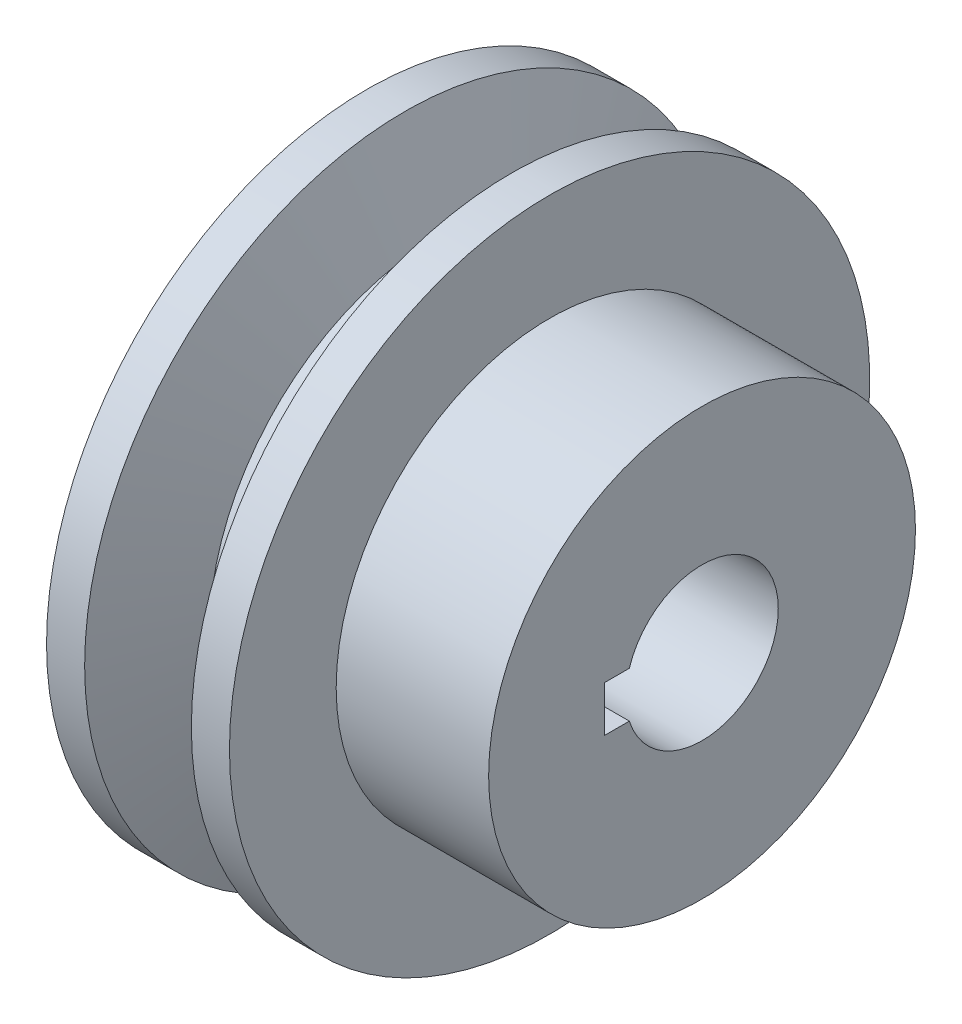
from build123d import *

# Parameters (mm, degrees)
CUT_EXTRUDE1_DEPTH = 37.959437225


with BuildPart() as part:
    # Sketch1 → Revolve1 (revolve)
    with BuildSketch(Plane.XY, mode=Mode.PRIVATE) as revolve1_sk:
        Polygon((0, 0), (22, 0), (22, 14), (12, 14), (12, 21), (9.5, 21), (7.316178594, 15), (4.683821406, 15), (2.5, 21), (0, 21), align=None)
    revolve(revolve1_sk.sketch.rotate(Axis((0, 0, 0), (1, 0, 0)), 90), axis=Axis((0, 0, 0), (1, 0, 0)))

    # Sketch2 → Cut-Extrude1 (cut, through all)
    with BuildSketch(Plane.ZY):
        with BuildLine():
            Line((4.769696007, 1.5), (6.4, 1.5))
            Line((6.4, 1.5), (6.4, -1.5))
            Line((6.4, -1.5), (4.769696007, -1.5))
            ThreePointArc((4.769696007, -1.5), (-5, 0), (4.769696007, 1.5))
        make_face()
    extrude(amount=-CUT_EXTRUDE1_DEPTH, mode=Mode.SUBTRACT)


solid = part.part
